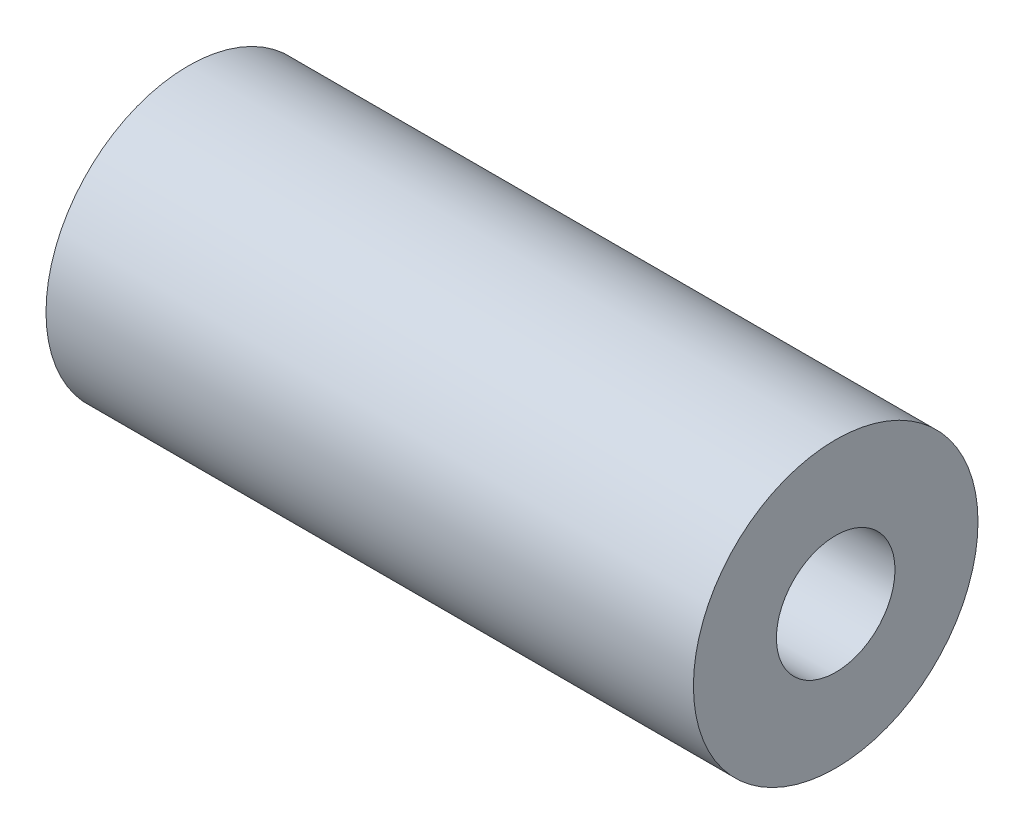
from build123d import *

# Parameters (mm, degrees)
SKETCH1_R                   = 3
BOSS_EXTRUDE1_DEPTH         = 13.65
TAP_DRILL_FOR_M3X0_5_TAP1_D = 2.5


with BuildPart() as part:
    # Sketch1 → Boss-Extrude1 (new body)
    with BuildSketch(Plane.YZ):
        with Locations(Location((0, 0, 0), (0, 0, 270))):
            Circle(SKETCH1_R)
    extrude(amount=BOSS_EXTRUDE1_DEPTH)

    # Tap Drill for M3x0.5 Tap1 (through all)
    with Locations(Plane(origin=(13.65, 0, 0), x_dir=(0, 0, -1), z_dir=(1, 0, 0))):
        with Locations((0, 0)):
            Hole(TAP_DRILL_FOR_M3X0_5_TAP1_D / 2)


solid = part.part
